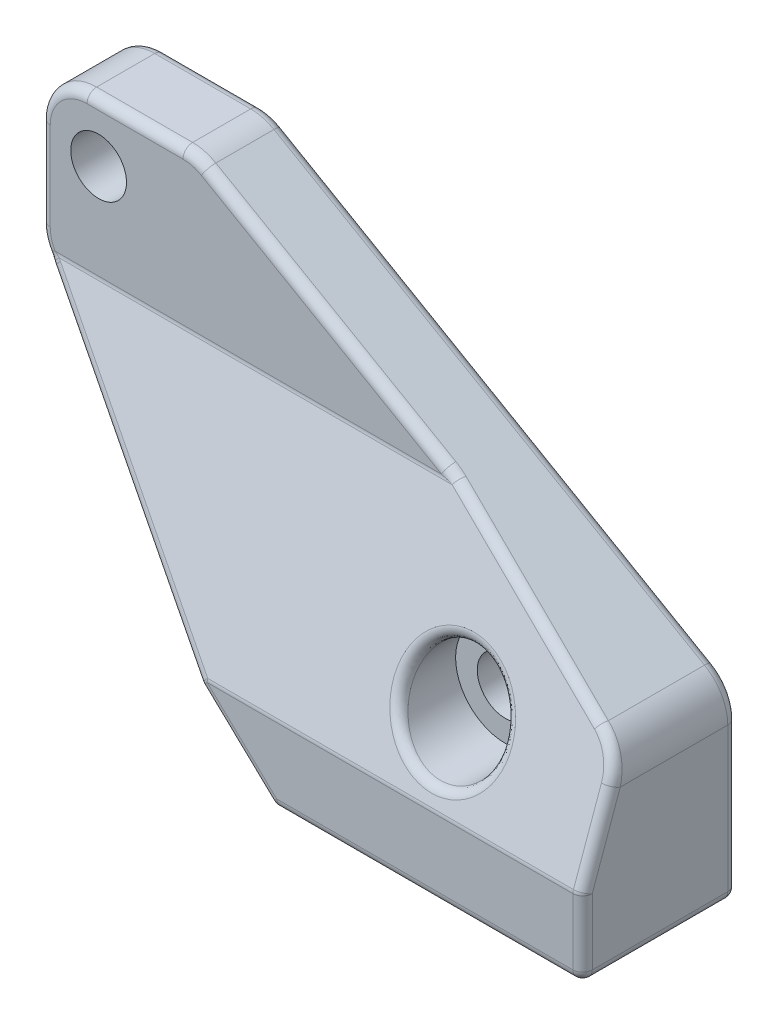
from build123d import *

# Parameters (mm, degrees)
SKETCH8_R           = 2.286
BOSS_EXTRUDE1_DEPTH = 12.7
SKETCH9_R           = 1.905
CUT_EXTRUDE4_DEPTH  = 15.875
CUT_EXTRUDE5_DEPTH  = 65.018582459
SKETCH11_R          = 4.064
CUT_EXTRUDE6_DEPTH  = 6.35
FILLET1_R           = 3.81
FILLET2_R           = 0.79375


with BuildPart() as part:
    # Sketch8 → Boss-Extrude1 (new body)
    with BuildSketch(Plane.XY):
        Polygon((0, 0), (-25.4, 0), (-50.8, 24.13), (-50.8, 36.83), (-38.1, 36.83), (0, 14.832954744), align=None)
        with Locations((-12.7, 11.826875)):
            Circle(SKETCH8_R, mode=Mode.SUBTRACT)
        with Locations((-46.0375, 32.0675)):
            Circle(SKETCH8_R, mode=Mode.SUBTRACT)
    extrude(amount=BOSS_EXTRUDE1_DEPTH)

    # Sketch9 → Cut-Extrude4 (cut)
    with BuildSketch(Plane.XZ):
        with Locations((-6.35, 6.35)):
            Circle(SKETCH9_R)
        with Locations((-19.05, 6.35)):
            Circle(SKETCH9_R)
    extrude(amount=-CUT_EXTRUDE4_DEPTH, mode=Mode.SUBTRACT)

    # Sketch10 → Cut-Extrude5 (cut, through all)
    with BuildSketch(Plane.ZY.offset(50.8)):
        Polygon((6.35, 36.83), (6.35, 24.13), (12.7, 6.35), (12.7, 36.83), align=None)
    extrude(amount=-CUT_EXTRUDE5_DEPTH, mode=Mode.SUBTRACT)

    # Sketch11 → Cut-Extrude6 (cut)
    with BuildSketch(Plane.XY.offset(12.7)):
        with Locations(Location((-12.7, 11.826875, 0), (0, 0, 270))):
            Circle(SKETCH11_R)
    extrude(amount=-CUT_EXTRUDE6_DEPTH, mode=Mode.SUBTRACT)

    # Fillet1
    fillet1_edges = [part.edges().sort_by_distance(p)[0] for p in [
        (-50.8, 24.13, 3.175),
        (-50.8, 36.83, 3.175),
        (-38.1, 36.83, 3.175),
        (0, 14.832954744, 4.835186653),
    ]]
    fillet(fillet1_edges, radius=FILLET1_R)

    # Fillet2
    fillet2_edges = [part.edges().sort_by_distance(p)[0] for p in [
        (0, 0, 6.35),
        (-25.4, 0, 6.35),
        (-12.7, 0, 12.7),
        (-28.742105263, 3.175, 12.7),
        (-9.003977372, 20.031403503, 7.813784463),
        (-16.042105263, 6.35, 12.7),
        (-40.849172988, 14.676714339, 9.72617345),
        (-33.266990546, 24.13, 6.35),
        (0, 3.175, 12.7),
        (-12.7, 0, 0),
        (-12.699987477, 15.890875, 9.292544643),
        (-37.507067725, 11.501714339, 0),
        (-50.8, 29.39283826, 0),
        (-43.055443212, 36.83, 0),
        (-19.560443212, 26.126181898, 0),
        (-0.510443212, 14.538250218, 0),
        (-38.134785861, 36.700177398, 0),
        (-49.684076836, 35.714076836, 0),
        (-50.491003861, 24.262655572, 0),
        (-50.8, 29.39283826, 6.35),
        (-43.055443212, 36.83, 6.35),
        (-26.659420584, 30.224778394, 6.35),
        (-38.134785861, 36.700177398, 6.35),
        (-49.684076836, 35.714076836, 6.35),
        (-50.706612058, 24.927288299, 6.35),
        (0, 9.491625109, 11.577991032),
        (0, 6.316625109, 0),
        (-0.498461944, 14.517345679, 9.783090829),
        (-50.076536566, 23.531981816, 6.563577923),
    ]]
    fillet(fillet2_edges, radius=FILLET2_R)


solid = part.part
